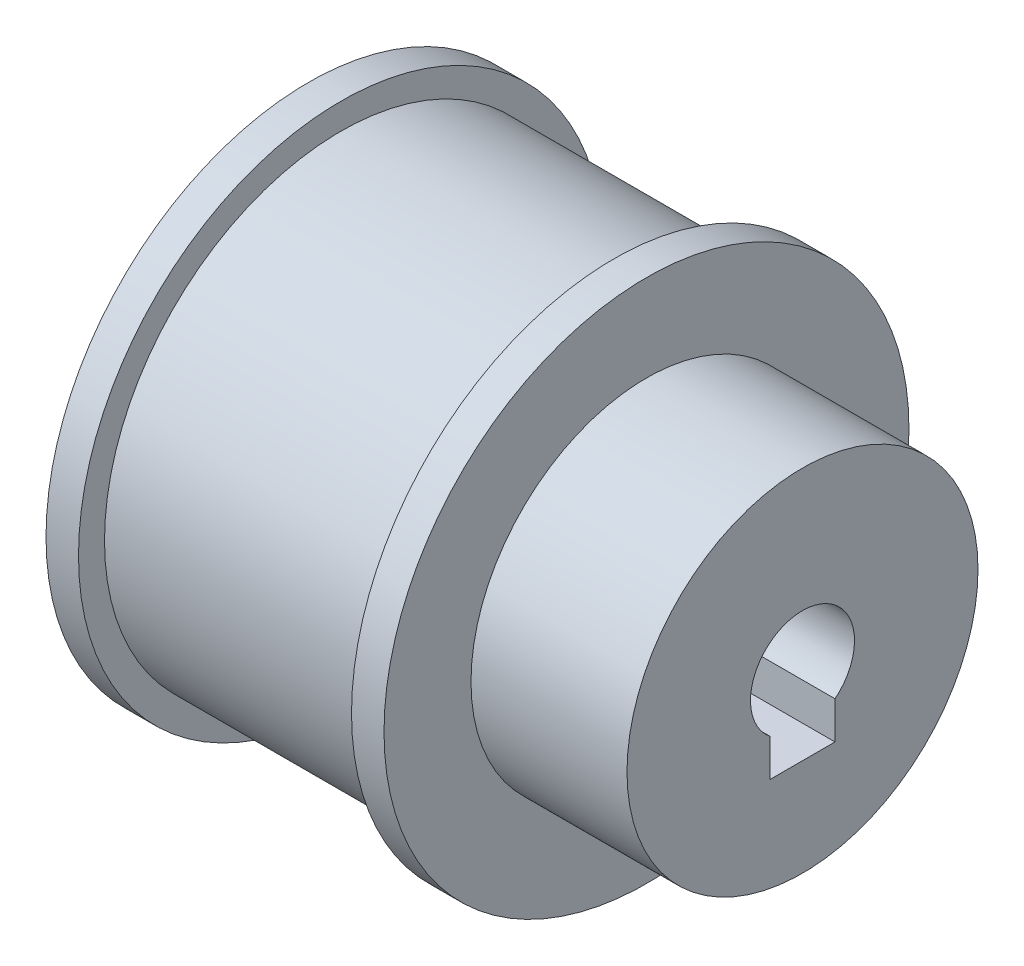
from build123d import *

# Parameters (mm, degrees)
CUT_EXTRUDE_1_DEPTH = 48.531801986


with BuildPart() as part:
    # 草图1 → 旋转1 (revolve)
    with BuildSketch(Plane.XY, mode=Mode.PRIVATE) as revolve_1_sk:
        Polygon((0, 0), (0, 20.19), (2.5, 20.19), (2.5, 18.19), (23.5, 18.19), (23.5, 20.19), (26, 20.19), (26, 13.5), (38, 13.5), (38, 0), align=None)
    revolve(revolve_1_sk.sketch.rotate(Axis((0, 0, 0), (1, 0, 0)), 90), axis=Axis((0, 0, 0), (1, 0, 0)))

    # 草图2 → 切除-拉伸1 (cut, through all)
    with BuildSketch(Plane(origin=(38, 0, 0), x_dir=(0, 0, -1), z_dir=(1, 0, 0))):
        with BuildLine():
            Line((-2.5, -3.122498999), (-2.5, -6))
            Line((-2.5, -6), (2.5, -6))
            Line((2.5, -6), (2.5, -3.122498999))
            ThreePointArc((2.5, -3.122498999), (0, 4), (-2.5, -3.122498999))
        make_face()
    extrude(amount=-CUT_EXTRUDE_1_DEPTH, mode=Mode.SUBTRACT)


solid = part.part
